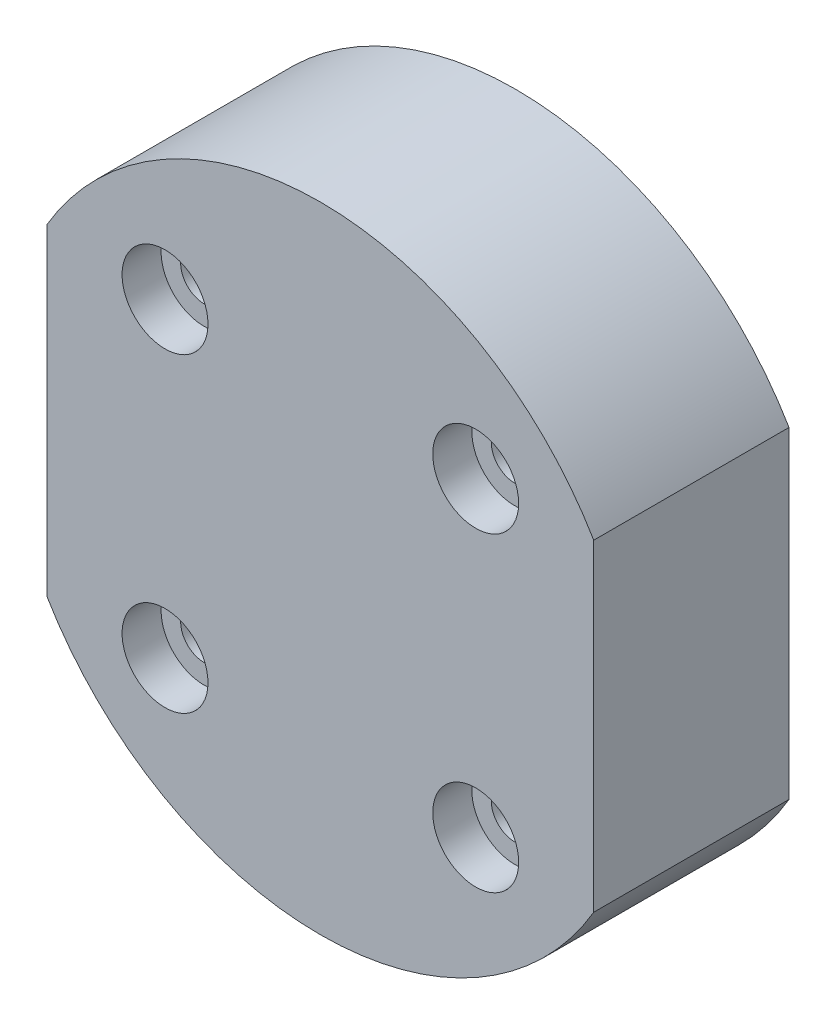
from build123d import *

# Parameters (mm, degrees)
SKETCH1_R                      = 16.25
BOSS_EXTRUDE1_DEPTH            = 10
CUT_EXTRUDE1_DEPTH             = 26.06242207
CUT_EXTRUDE1_DEPTH_BACK        = 26.06242207
SKETCH2_W                      = 10
SKETCH2_H                      = 16.5
CBORE_FOR_M2_SHCS1_D           = 2.4
CBORE_FOR_M2_SHCS1_CBORE_D     = 4.4
CBORE_FOR_M2_SHCS1_CBORE_DEPTH = 2


with BuildPart() as part:
    # Sketch1 → Boss-Extrude1 (new body)
    with BuildSketch(Plane.XY):
        Circle(SKETCH1_R)
    extrude(amount=-BOSS_EXTRUDE1_DEPTH)

    # Sketch2 → Cut-Extrude1 (cut, two sides: drawn at the far end of the back side and taken through both)
    with BuildSketch(Plane.XY.offset(-CUT_EXTRUDE1_DEPTH_BACK)):
        with Locations((19, 0)):
            Rectangle(SKETCH2_W, SKETCH2_H)
        with Locations((-19, 0)):
            Rectangle(SKETCH2_W, SKETCH2_H)
    extrude(amount=CUT_EXTRUDE1_DEPTH + CUT_EXTRUDE1_DEPTH_BACK, mode=Mode.SUBTRACT)

    # CBORE for M2 SHCS1 (through all)
    with Locations(Plane.XY):
        with Locations((-7.954951288, 7.954951288), (7.954951288, 7.954951288), (7.954951288, -7.954951288), (-7.954951288, -7.954951288)):
            CounterBoreHole(CBORE_FOR_M2_SHCS1_D / 2, CBORE_FOR_M2_SHCS1_CBORE_D / 2, CBORE_FOR_M2_SHCS1_CBORE_DEPTH)


solid = part.part
